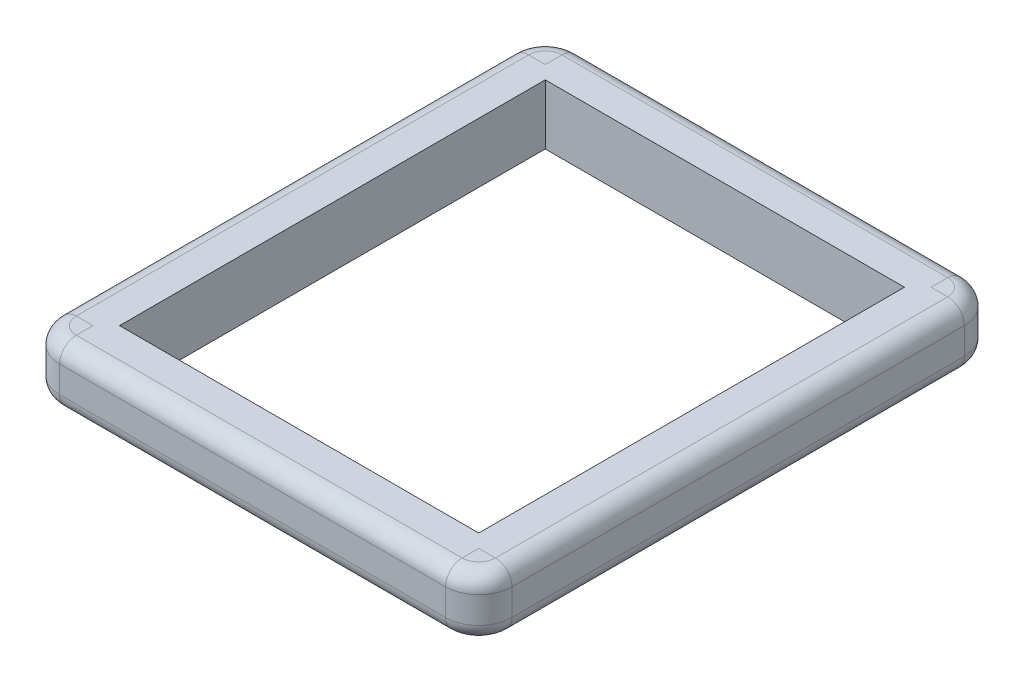
from build123d import *

# Parameters (mm, degrees)
BOSS_EXTRUDE1_START = 38.1
SKETCH2_W           = 736.6
SKETCH2_H           = 863.6
SKETCH2_W_2         = 685.8
SKETCH2_H_2         = 812.8
BOSS_EXTRUDE1_DEPTH = 114.3


with BuildPart() as part:
    # Sketch2 → Boss-Extrude1 (new body)
    with BuildSketch(Plane(origin=(0, 0, 0), x_dir=(1, 0, 0), z_dir=(0, 1, 0)).offset(BOSS_EXTRUDE1_START)):
        Rectangle(SKETCH2_W, SKETCH2_H)
        Rectangle(SKETCH2_W_2, SKETCH2_H_2, mode=Mode.SUBTRACT)
    extrude(amount=BOSS_EXTRUDE1_DEPTH)

    # Sweep1: sweep along a path in Sketch4
    with BuildLine(Plane(origin=(0, 152.4, 0), x_dir=(1, 0, 0), z_dir=(0, 1, 0))) as sweep1_path:
        Line((368.3, 495.3), (-368.3, 495.3))
        ThreePointArc((-368.3, 495.3), (-413.201280605, 476.701280605), (-431.8, 431.8))
        Line((-431.8, 431.8), (-431.8, -431.8))
        ThreePointArc((-431.8, -431.8), (-413.201280605, -476.701280605), (-368.3, -495.3))
        Line((-368.3, -495.3), (368.3, -495.3))
        ThreePointArc((368.3, -495.3), (413.201280605, -476.701280605), (431.8, -431.8))
        Line((431.8, -431.8), (431.8, 431.8))
        ThreePointArc((431.8, 431.8), (413.201280605, 476.701280605), (368.3, 495.3))
    # Sketch3 → Sweep1 (sweep)
    with BuildSketch(Plane.XY.offset(431.8)):
        with BuildLine():
            Line((-400.05, 152.4), (-368.3, 152.4))
            Line((-368.3, 152.4), (-368.3, 38.1))
            Line((-368.3, 38.1), (-400.05, 38.1))
            ThreePointArc((-400.05, 38.1), (-422.500640303, 47.399359697), (-431.8, 69.85))
            Line((-431.8, 69.85), (-431.8, 120.65))
            ThreePointArc((-431.8, 120.65), (-422.500640303, 143.100640303), (-400.05, 152.4))
        make_face()
    sweep(path=sweep1_path.line)


solid = part.part
